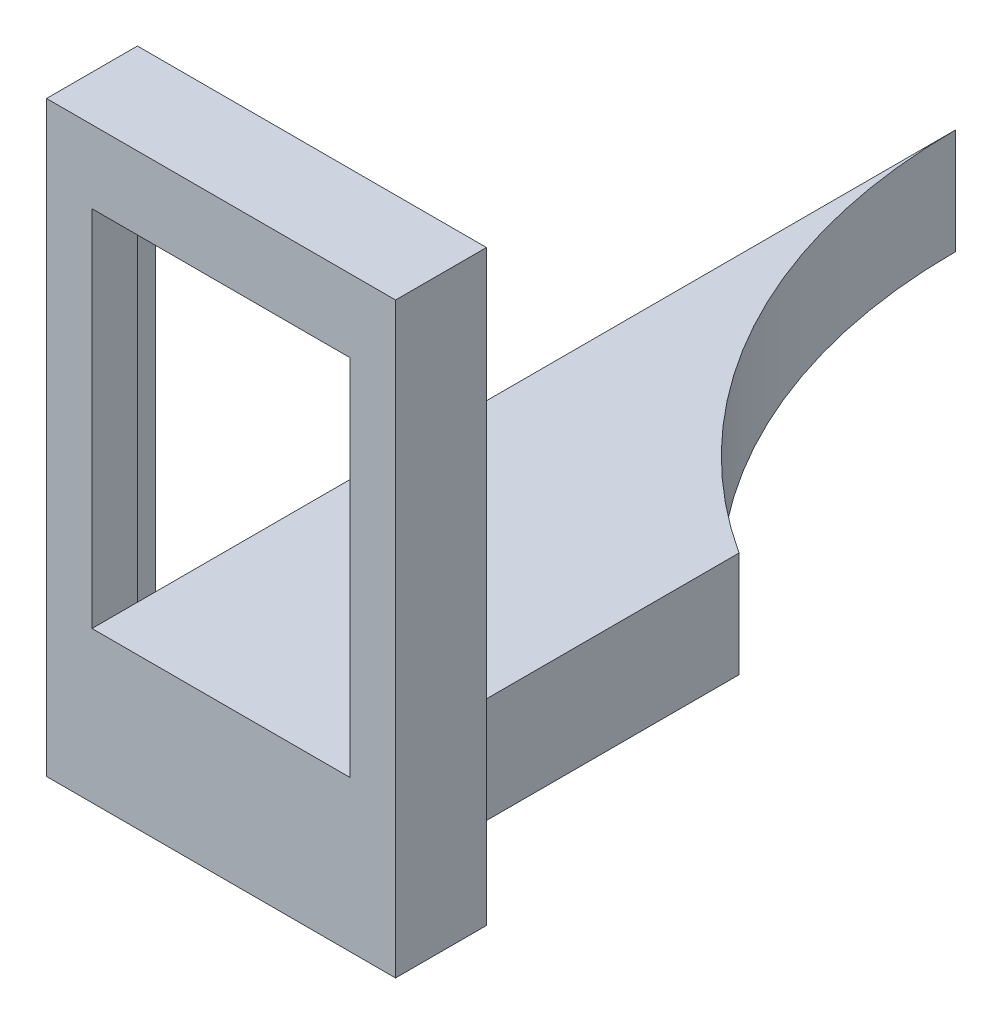
from build123d import *

# Parameters (mm, degrees)
SKETCH_8_W          = 34.4
SKETCH_8_H          = 60.6
SKETCH_8_W_2        = 28.4
SKETCH_8_H_2        = 51.6
EXTRUDE_4_DEPTH     = 5
SKETCH_9_W          = 28.4
SKETCH_9_H          = 11.6
EXTRUDE_5_DEPTH     = 95
SKETCH_10_R         = 62.2
CUT_EXTRUDE_3_DEPTH = 100
SKETCH_13_W         = 38.4
SKETCH_13_H         = 64.6
SKETCH_13_W_2       = 34.4
SKETCH_13_H_2       = 60.6
EXTRUDE_7_DEPTH     = 10


with BuildPart() as part:
    # 스케치8 → 보스-돌출4 (new body)
    with BuildSketch(Plane.XY):
        with Locations((17.2, 30.3)):
            Rectangle(SKETCH_8_W, SKETCH_8_H)
        with Locations((17.2, 28.8)):
            Rectangle(SKETCH_8_W_2, SKETCH_8_H_2, mode=Mode.SUBTRACT)
    extrude(amount=-EXTRUDE_4_DEPTH)

    # 스케치9 → 보스-돌출5 (add)
    with BuildSketch(Plane.XY):
        with Locations((17.2, 8.8)):
            Rectangle(SKETCH_9_W, SKETCH_9_H)
    extrude(amount=-EXTRUDE_5_DEPTH)

    # 스케치10 → 컷-돌출3 (cut)
    with BuildSketch(Plane(origin=(0, 14.6, 0), x_dir=(1, 0, 0), z_dir=(0, 1, 0))):
        with Locations((65.2, 95)):
            Circle(SKETCH_10_R)
    extrude(amount=-CUT_EXTRUDE_3_DEPTH, mode=Mode.SUBTRACT)

    # 스케치13 → 보스-돌출7 (add)
    with BuildSketch(Plane.XY):
        with Locations((17.2, 30.3)):
            Rectangle(SKETCH_13_W, SKETCH_13_H)
        with Locations((17.2, 30.3)):
            Rectangle(SKETCH_13_W_2, SKETCH_13_H_2, mode=Mode.SUBTRACT)
    extrude(amount=-EXTRUDE_7_DEPTH)


solid = part.part
